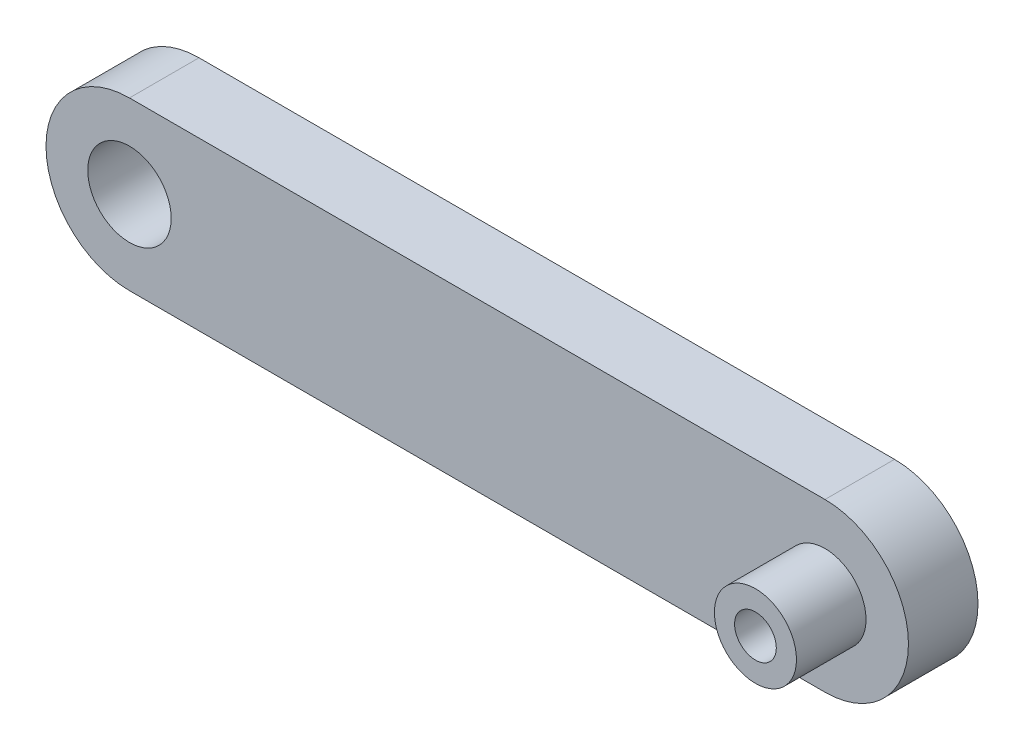
from build123d import *

# Parameters (mm, degrees)
SKETCH1_R           = 1.5
SKETCH1_R_2         = 3
BOSS_EXTRUDE1_DEPTH = 5
SKETCH2_R           = 2.95
SKETCH2_R_2         = 1.5
BOSS_EXTRUDE2_DEPTH = 5


with BuildPart() as part:
    # Sketch1 → Boss-Extrude1 (new body)
    with BuildSketch(Plane.XY):
        with BuildLine():
            Line((-25, 6), (25, 6))
            ThreePointArc((25, 6), (31, 0), (25, -6))
            Line((25, -6), (-25, -6))
            ThreePointArc((-25, -6), (-31, 0), (-25, 6))
        make_face()
        with Locations((25, 0)):
            Circle(SKETCH1_R, mode=Mode.SUBTRACT)
        with Locations((-25, 0)):
            Circle(SKETCH1_R_2, mode=Mode.SUBTRACT)
    extrude(amount=BOSS_EXTRUDE1_DEPTH)

    # Sketch2 → Boss-Extrude2 (add)
    with BuildSketch(Plane.XY.offset(5)):
        with Locations((25, 0)):
            Circle(SKETCH2_R)
        with Locations((25, 0)):
            Circle(SKETCH2_R_2, mode=Mode.SUBTRACT)
    extrude(amount=BOSS_EXTRUDE2_DEPTH)


solid = part.part
